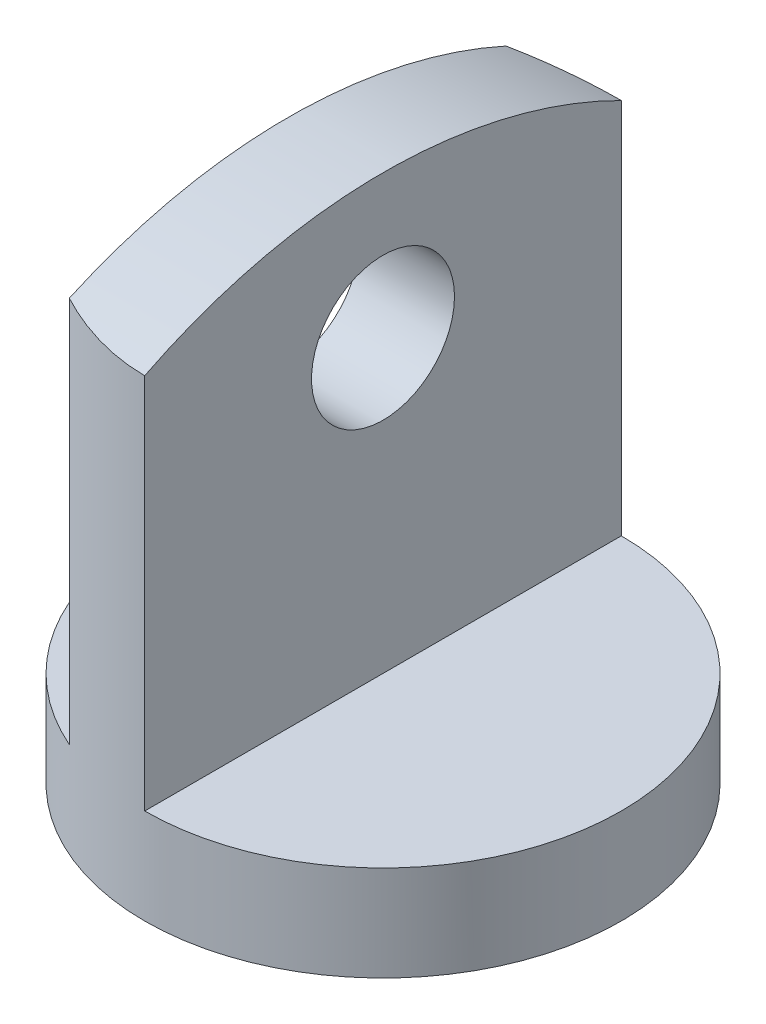
from build123d import *

# Parameters (mm, degrees)
BOSS_EXTRUDE1_START = 455
BOSS_EXTRUDE1_DEPTH = 455
SKETCH4_R           = 75
CUT_EXTRUDE1_DEPTH  = 100


with BuildPart() as part:
    # Sketch1 → Revolve1 (revolve)
    with BuildSketch(Plane.XY, mode=Mode.PRIVATE) as revolve1_sk:
        Polygon((0, 50), (125, 50), (125, 0), (250, 0), (250, 100), (0, 100), align=None)
    revolve(revolve1_sk.sketch.rotate(Axis((0, 188.75, 0), (0, -1, 0)), 90), axis=Axis((0, 188.75, 0), (0, -1, 0)))

    # Sketch3 → Boss-Extrude1 (add)
    with BuildSketch(Plane(origin=(0, 100, 0), x_dir=(1, 0, 0), z_dir=(0, 1, 0)).offset(BOSS_EXTRUDE1_START)):
        with BuildLine():
            Line((0, 250), (0, -250))
            ThreePointArc((0, -250), (-51.077410922, -244.726578233), (-100, -229.128784748))
            Line((-100, -229.128784748), (-100, 229.128784748))
            ThreePointArc((-100, 229.128784748), (-51.077410922, 244.726578233), (0, 250))
        make_face()
    extrude(amount=-BOSS_EXTRUDE1_DEPTH)

    # Sketch4 → Cut-Extrude1 (cut)
    with BuildSketch(Plane(origin=(0, 0, 0), x_dir=(0, 0, -1), z_dir=(1, 0, 0))):
        with Locations((0, 405)):
            Circle(SKETCH4_R)
        with BuildLine():
            Line((-250, 555), (-250, 495.504793115))
            ThreePointArc((-250, 495.504793115), (-128.490932522, 539.921364885), (1.363e-06, 555))
            Line((1.363e-06, 555), (-250, 555))
        make_face()
        with BuildLine():
            Line((250, 555), (1.363e-06, 555))
            ThreePointArc((1.363e-06, 555), (128.490933847, 539.92136457), (250, 495.504793115))
            Line((250, 495.504793115), (250, 555))
        make_face()
    extrude(amount=-CUT_EXTRUDE1_DEPTH, mode=Mode.SUBTRACT)


solid = part.part
